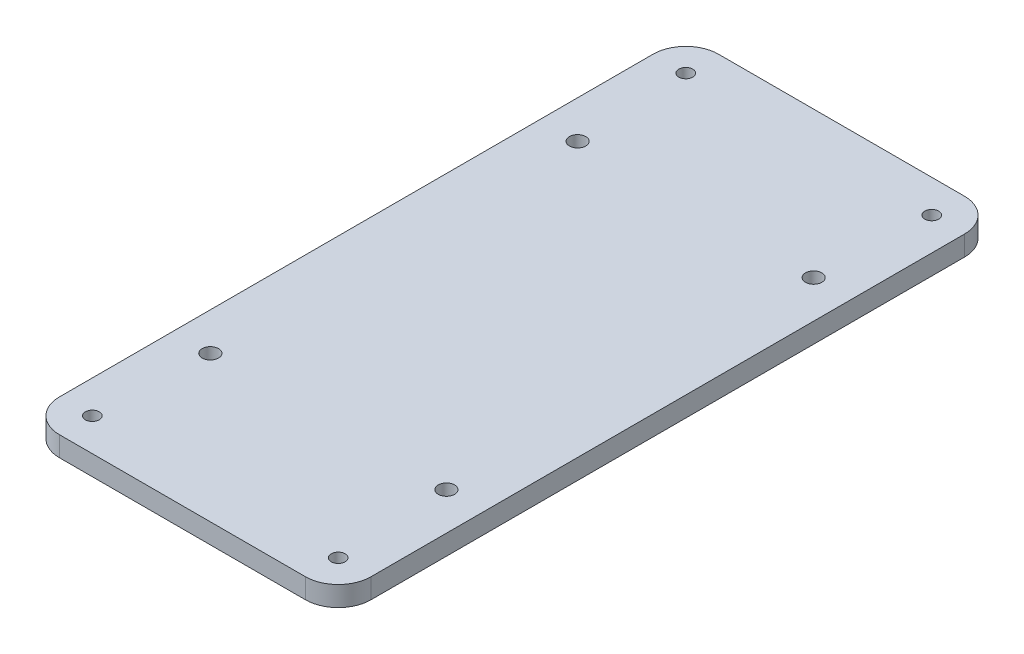
from build123d import *

# Parameters (mm, degrees)
SKETCH1_R           = 2.5
SKETCH1_R_2         = 2.125
BOSS_EXTRUDE1_DEPTH = 6.096


with BuildPart() as part:
    # Sketch1 → Boss-Extrude1 (new body)
    with BuildSketch(Plane(origin=(0, 0, 0), x_dir=(1, 0, 0), z_dir=(0, 1, 0))):
        with BuildLine():
            Line((-37.5, 100.5), (37.5, 100.5))
            ThreePointArc((37.5, 100.5), (44.571067812, 97.571067812), (47.5, 90.5))
            Line((47.5, 90.5), (47.5, -90.5))
            ThreePointArc((47.5, -90.5), (44.571067812, -97.571067812), (37.5, -100.5))
            Line((37.5, -100.5), (-37.5, -100.5))
            ThreePointArc((-37.5, -100.5), (-44.571067812, -97.571067812), (-47.5, -90.5))
            Line((-47.5, -90.5), (-47.5, 90.5))
            ThreePointArc((-47.5, 90.5), (-44.571067812, 97.571067812), (-37.5, 100.5))
        make_face()
        with Locations(Location((-36, 56, 0), (0, 0, 90))):
            Circle(SKETCH1_R, mode=Mode.SUBTRACT)
        with Locations(Location((36, 56, 0), (0, 0, 90))):
            Circle(SKETCH1_R, mode=Mode.SUBTRACT)
        with Locations(Location((36, -56, 0), (0, 0, 90))):
            Circle(SKETCH1_R, mode=Mode.SUBTRACT)
        with Locations(Location((-36, -56, 0), (0, 0, 90))):
            Circle(SKETCH1_R, mode=Mode.SUBTRACT)
        with Locations(Location((-37.5, 90.5, 0), (0, 0, 90))):
            Circle(SKETCH1_R_2, mode=Mode.SUBTRACT)
        with Locations(Location((37.5, 90.5, 0), (0, 0, 90))):
            Circle(SKETCH1_R_2, mode=Mode.SUBTRACT)
        with Locations(Location((37.5, -90.5, 0), (0, 0, 90))):
            Circle(SKETCH1_R_2, mode=Mode.SUBTRACT)
        with Locations(Location((-37.5, -90.5, 0), (0, 0, 90))):
            Circle(SKETCH1_R_2, mode=Mode.SUBTRACT)
    extrude(amount=BOSS_EXTRUDE1_DEPTH)


solid = part.part
